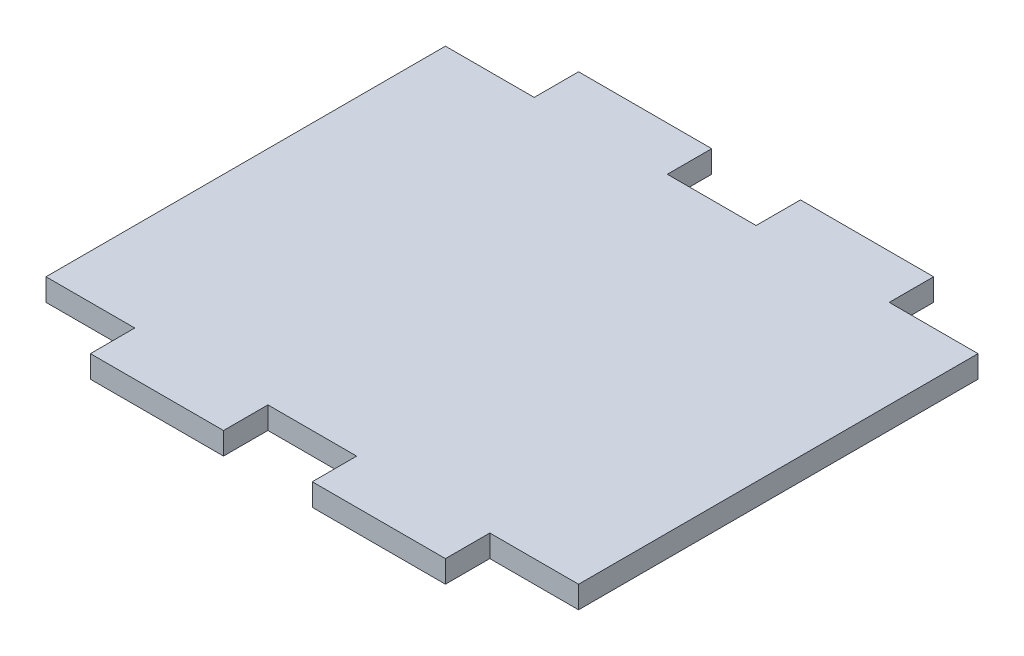
from build123d import *

# Parameters (mm, degrees)
SKETCH1_W           = 76.2
SKETCH1_H           = 3.175
BOSS_EXTRUDE1_DEPTH = 69.85
SKETCH2_W           = 12.7
SKETCH2_H           = 6.35
CUT_EXTRUDE1_DEPTH  = 439.214737942


with BuildPart() as part:
    # Sketch1 → Boss-Extrude1 (new body)
    with BuildSketch(Plane.XY):
        with Locations((-394.500339141, 196.359630659)):
            Rectangle(SKETCH1_W, SKETCH1_H)
    extrude(amount=-BOSS_EXTRUDE1_DEPTH)

    # Sketch2 → Cut-Extrude1 (cut, through all)
    with BuildSketch(Plane(origin=(0, 197.947130659, 0), x_dir=(1, 0, 0), z_dir=(0, 1, 0))):
        with Locations((-362.750339141, 3.175)):
            Rectangle(SKETCH2_W, SKETCH2_H)
        with Locations((-394.500339141, 3.175)):
            Rectangle(SKETCH2_W, SKETCH2_H)
        with Locations((-426.250339141, 3.175)):
            Rectangle(SKETCH2_W, SKETCH2_H)
        with Locations((-362.750339141, 66.675)):
            Rectangle(SKETCH2_W, SKETCH2_H)
        with Locations((-394.500339141, 66.675)):
            Rectangle(SKETCH2_W, SKETCH2_H)
        with Locations((-426.250339141, 66.675)):
            Rectangle(SKETCH2_W, SKETCH2_H)
    extrude(amount=-CUT_EXTRUDE1_DEPTH, mode=Mode.SUBTRACT)


solid = part.part
